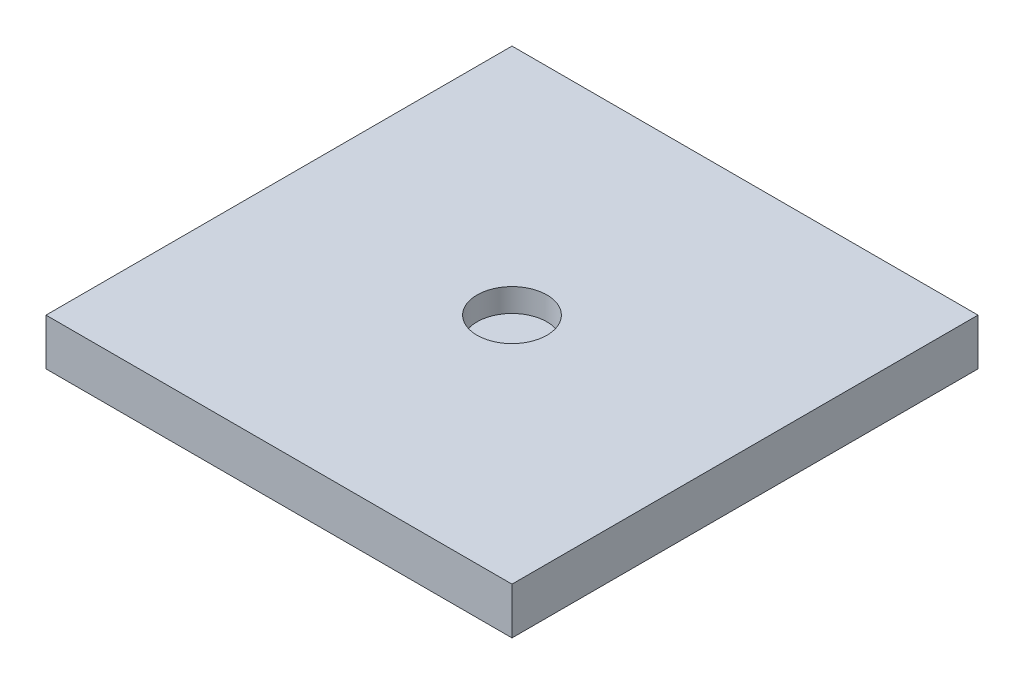
from build123d import *

# Parameters (mm, degrees)
SKETCH1_W           = 40
SKETCH1_H           = 40
BOSS_EXTRUDE1_DEPTH = 4
SKETCH2_R           = 3
CUT_EXTRUDE1_DEPTH  = 2


with BuildPart() as part:
    # Sketch1 → Boss-Extrude1 (new body)
    with BuildSketch(Plane(origin=(0, 0, 0), x_dir=(1, 0, 0), z_dir=(0, 1, 0))):
        Rectangle(SKETCH1_W, SKETCH1_H)
    extrude(amount=BOSS_EXTRUDE1_DEPTH)

    # Sketch2 → Cut-Extrude1 (cut)
    with BuildSketch(Plane(origin=(0, 4, 0), x_dir=(1, 0, 0), z_dir=(0, 1, 0))):
        with Locations(Location((0, 0, 0), (0, 0, 270))):
            Circle(SKETCH2_R)
    extrude(amount=-CUT_EXTRUDE1_DEPTH, mode=Mode.SUBTRACT)


solid = part.part
